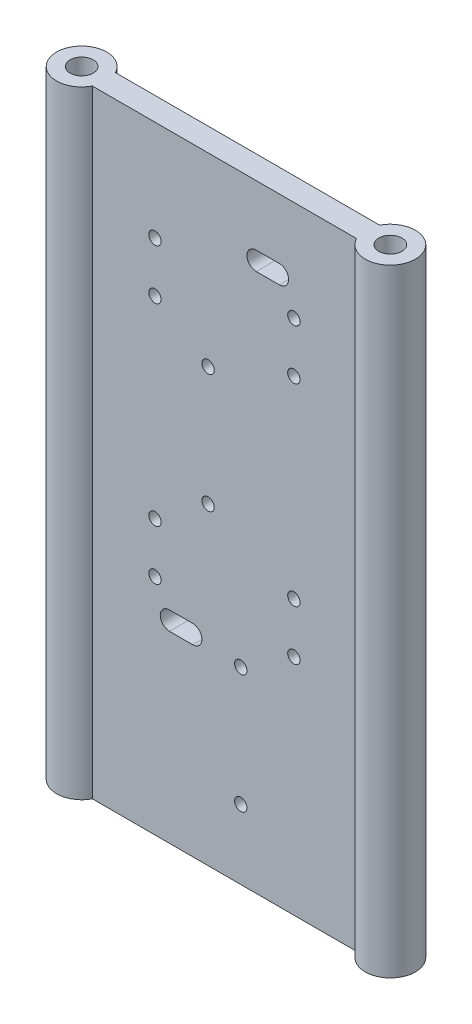
from build123d import *

# Parameters (mm, degrees)
BOSS_EXTRUDE1_DEPTH     = 203.2
SKETCH2_R               = 3.81
CUT_EXTRUDE1_DEPTH      = 203.2
CUT_EXTRUDE2_DEPTH      = 28.956
CUT_EXTRUDE2_DEPTH_BACK = 36.322
SKETCH5_R               = 2.032
CUT_EXTRUDE3_DEPTH      = 45.974
SKETCH6_R               = 2.032
CUT_EXTRUDE4_DEPTH      = 7.62


with BuildPart() as part:
    # Sketch1 → Boss-Extrude1 (new body)
    with BuildSketch(Plane(origin=(0, 0, 0), x_dir=(1, 0, 0), z_dir=(0, 1, 0))):
        with BuildLine():
            Line((-43.476822752, 3.81), (43.476822752, 3.81))
            ThreePointArc((43.476822752, 3.81), (59.055, 0), (43.476822752, -3.81))
            Line((43.476822752, -3.81), (-43.476822752, -3.81))
            ThreePointArc((-43.476822752, -3.81), (-59.055, 0), (-43.476822752, 3.81))
        make_face()
    extrude(amount=BOSS_EXTRUDE1_DEPTH)

    # Sketch2 → Cut-Extrude1 (cut)
    with BuildSketch(Plane.XZ):
        with Locations(Location((-50.8, 0, 0), (0, 0, 270))):
            Circle(SKETCH2_R)
        with Locations(Location((50.8, 0, 0), (0, 0, 270))):
            Circle(SKETCH2_R)
    extrude(amount=-CUT_EXTRUDE1_DEPTH, mode=Mode.SUBTRACT)

    # Sketch3 → Cut-Extrude2 (cut, two sides: drawn at the far end of the back side and taken through both)
    with BuildSketch(Plane.XY.offset(3.81).offset(-CUT_EXTRUDE2_DEPTH_BACK)):
        with BuildLine():
            Line((18.076822752, 177.292), (10.456822752, 177.292))
            ThreePointArc((10.456822752, 177.292), (7.408822752, 180.34), (10.456822752, 183.388))
            Line((10.456822752, 183.388), (18.076822752, 183.388))
            ThreePointArc((18.076822752, 183.388), (21.124822752, 180.34), (18.076822752, 177.292))
        make_face()
        with BuildLine():
            Line((-18.076822752, 66.548), (-10.456822752, 66.548))
            ThreePointArc((-10.456822752, 66.548), (-7.408822752, 63.5), (-10.456822752, 60.452))
            Line((-10.456822752, 60.452), (-18.076822752, 60.452))
            ThreePointArc((-18.076822752, 60.452), (-21.124822752, 63.5), (-18.076822752, 66.548))
        make_face()
    extrude(amount=CUT_EXTRUDE2_DEPTH + CUT_EXTRUDE2_DEPTH_BACK, mode=Mode.SUBTRACT)

    # Sketch5 → Cut-Extrude3 (cut)
    with BuildSketch(Plane(origin=(0, 0, -3.81), x_dir=(-1, 0, 0), z_dir=(0, 0, -1))):
        with Locations((-22.86, 170.18)):
            Circle(SKETCH5_R)
        with Locations((-22.86, 153.67)):
            Circle(SKETCH5_R)
        with Locations((22.86, 170.18)):
            Circle(SKETCH5_R)
        with Locations((22.86, 153.67)):
            Circle(SKETCH5_R)
        with Locations((-22.86, 90.17)):
            Circle(SKETCH5_R)
        with Locations((-22.86, 73.66)):
            Circle(SKETCH5_R)
        with Locations((22.86, 90.17)):
            Circle(SKETCH5_R)
        with Locations((22.86, 73.66)):
            Circle(SKETCH5_R)
    extrude(amount=-CUT_EXTRUDE3_DEPTH, mode=Mode.SUBTRACT)

    # Sketch6 → Cut-Extrude4 (cut)
    with BuildSketch(Plane.XY.offset(3.81)):
        with Locations((5.376822752, 61.976)):
            Circle(SKETCH6_R)
        with Locations((5.376822752, 22.86)):
            Circle(SKETCH6_R)
        with Locations((-5.376822752, 142.24)):
            Circle(SKETCH6_R)
        with Locations((-5.376822752, 103.124)):
            Circle(SKETCH6_R)
    extrude(amount=-CUT_EXTRUDE4_DEPTH, mode=Mode.SUBTRACT)


solid = part.part
